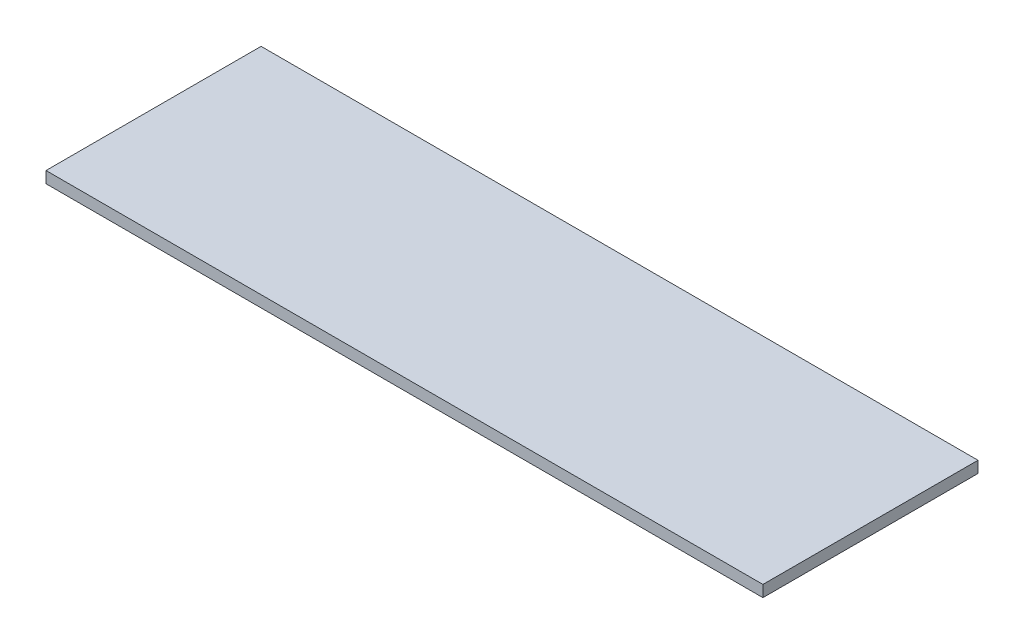
from build123d import *

# Parameters (mm, degrees)
SKETCH1_W           = 100
SKETCH1_H           = 30
BOSS_EXTRUDE1_DEPTH = 1.6


with BuildPart() as part:
    # Sketch1 → Boss-Extrude1 (new body)
    with BuildSketch(Plane(origin=(0, 0, 0), x_dir=(1, 0, 0), z_dir=(0, 1, 0))):
        Rectangle(SKETCH1_W, SKETCH1_H)
    extrude(amount=-BOSS_EXTRUDE1_DEPTH)


solid = part.part
